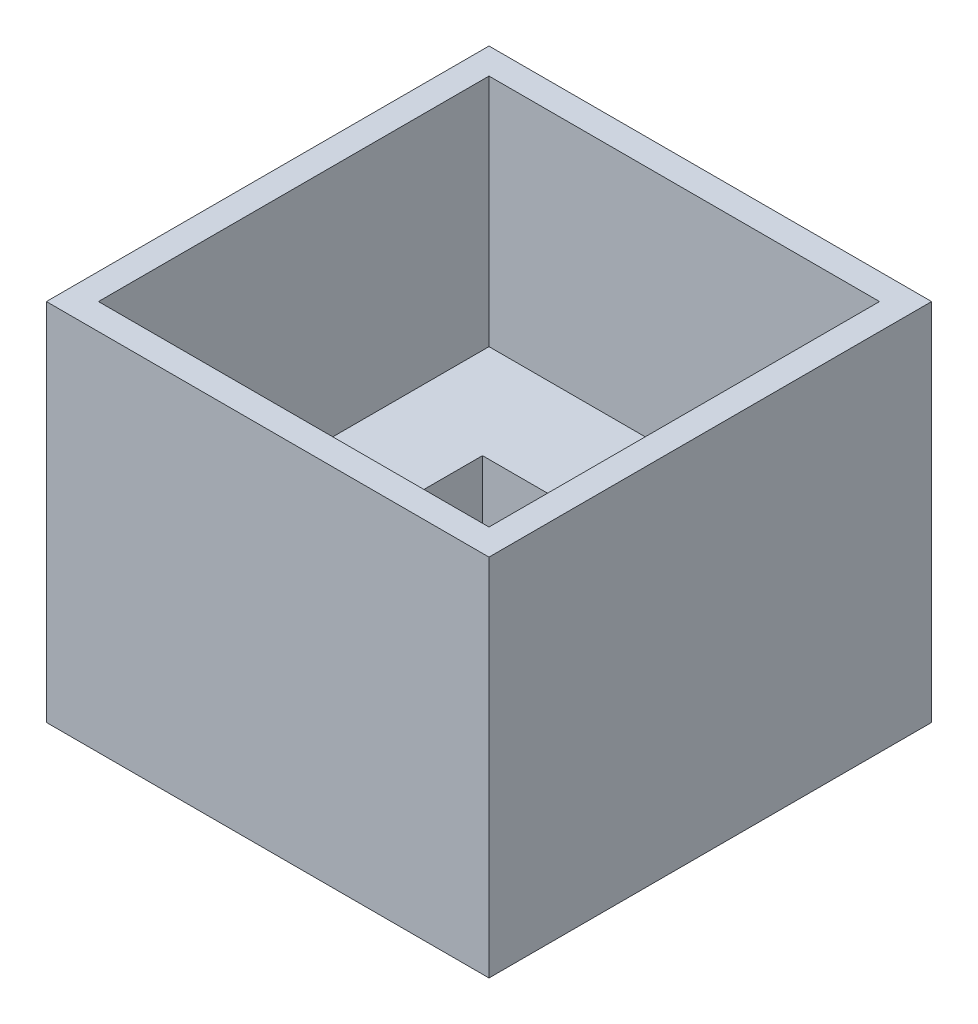
from build123d import *

# Parameters (mm, degrees)
SKETCH_2_W          = 170
SKETCH_2_H          = 170
EXTRUDE_1_DEPTH     = 140
SKETCH_3_W          = 150
SKETCH_3_H          = 150
CUT_EXTRUDE_1_DEPTH = 90
CUT_EXTRUDE_2_REACH = 152.167
SKETCH_4_W          = 80
SKETCH_4_H          = 75


with BuildPart() as part:
    # Эскиз2 → Бобышка-Вытянуть1 (new body)
    with BuildSketch(Plane(origin=(0, 0, 0), x_dir=(1, 0, 0), z_dir=(0, 1, 0))):
        Rectangle(SKETCH_2_W, SKETCH_2_H)
    extrude(amount=EXTRUDE_1_DEPTH)

    # Эскиз3 → Вырез-Вытянуть1 (cut)
    with BuildSketch(Plane(origin=(0, 140, 0), x_dir=(1, 0, 0), z_dir=(0, 1, 0))):
        Rectangle(SKETCH_3_W, SKETCH_3_H)
    extrude(amount=-CUT_EXTRUDE_1_DEPTH, mode=Mode.SUBTRACT)

    # Эскиз4 → Вырез-Вытянуть2 (cut, up to next)
    with BuildSketch(Plane(origin=(0, 50, 0), x_dir=(1, 0, 0), z_dir=(0, 1, 0)), mode=Mode.PRIVATE) as cut_extrude_2_sk1:
        Rectangle(SKETCH_4_W, SKETCH_4_H)
    cut_extrude_2_tool1 = extrude(cut_extrude_2_sk1.sketch, amount=-CUT_EXTRUDE_2_REACH, mode=Mode.PRIVATE) & part.part
    add(cut_extrude_2_tool1.solids().sort_by_distance((0, 50, 0))[0], mode=Mode.SUBTRACT)


solid = part.part
